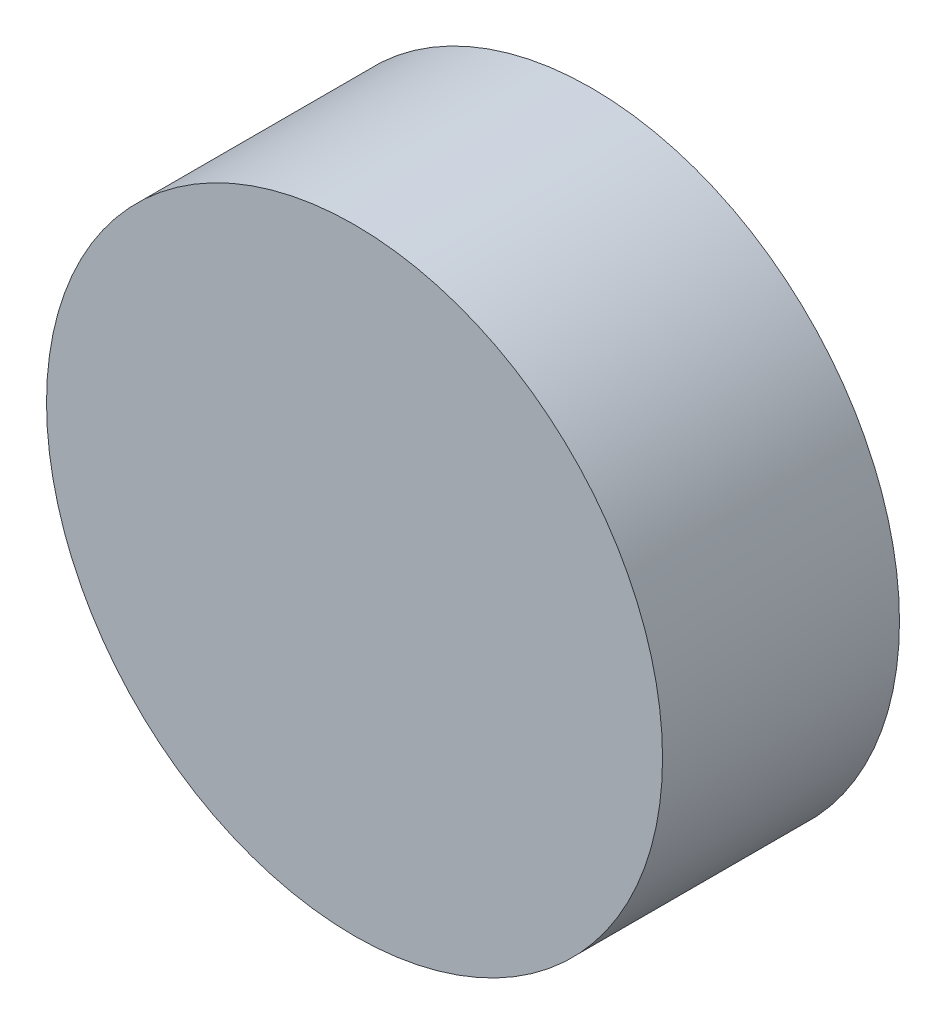
from build123d import *

# Parameters (mm, degrees)
SKETCH_1_R            = 32.5
ABOT_LEFT_WHEEL_DEPTH = 25


with BuildPart() as part:
    # Эскиз1 → abot_left_wheel (new body)
    with BuildSketch(Plane.XY):
        Circle(SKETCH_1_R)
    extrude(amount=ABOT_LEFT_WHEEL_DEPTH)


solid = part.part
